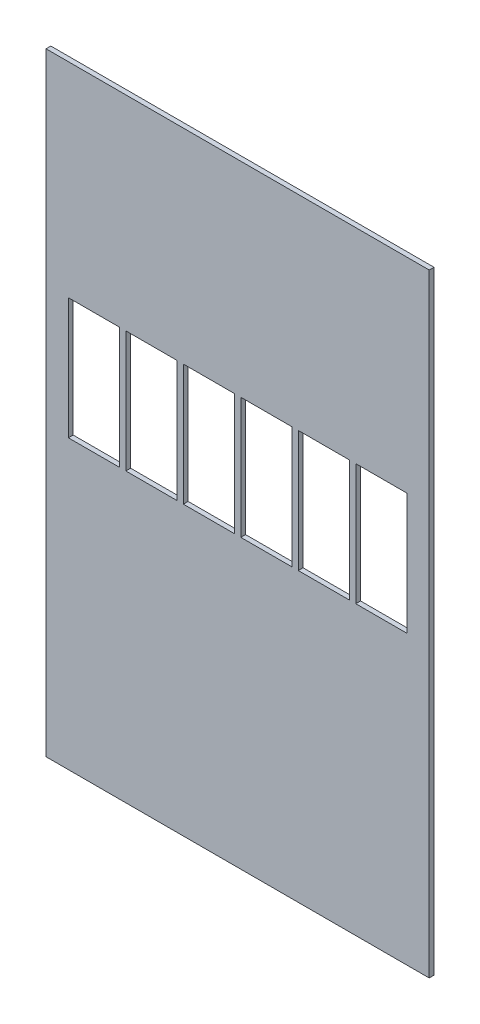
from build123d import *

# Parameters (mm, degrees)
SKETCH1_W               = 2743.2
SKETCH1_H               = 1066.8
BOSS_EXTRUDE1_DEPTH     = 38.1
CUT_EXTRUDE1_DEPTH      = 1473.159546381
CUT_EXTRUDE1_DEPTH_BACK = 1473.159546381
SKETCH2_W               = 406.4
SKETCH2_H               = 965.2
SKETCH3_W               = 2743.2
SKETCH3_H               = 38.1
BOSS_EXTRUDE2_DEPTH     = 2235.2
SKETCH4_W               = 2743.2
SKETCH4_H               = 38.1
BOSS_EXTRUDE3_DEPTH     = 1574.8
SKETCH5_W               = 38.1
SKETCH5_H               = 4876.8
BOSS_EXTRUDE4_DEPTH     = 152.4


with BuildPart() as part:
    # Sketch1 → Boss-Extrude1 (new body)
    with BuildSketch(Plane.XY):
        Rectangle(SKETCH1_W, SKETCH1_H)
    extrude(amount=BOSS_EXTRUDE1_DEPTH)

    # Sketch2 → Cut-Extrude1 (cut, two sides: drawn at the far end of the back side and taken through both)
    with BuildSketch(Plane.XY.offset(38.1).offset(-CUT_EXTRUDE1_DEPTH_BACK)):
        with Locations((-1143, 0)):
            Rectangle(SKETCH2_W, SKETCH2_H)
        with Locations((-685.8, 0)):
            Rectangle(SKETCH2_W, SKETCH2_H)
        with Locations((-228.6, 0)):
            Rectangle(SKETCH2_W, SKETCH2_H)
        with Locations((228.6, 0)):
            Rectangle(SKETCH2_W, SKETCH2_H)
        with Locations((685.8, 0)):
            Rectangle(SKETCH2_W, SKETCH2_H)
        with Locations((1143, 0)):
            Rectangle(SKETCH2_W, SKETCH2_H)
    extrude(amount=CUT_EXTRUDE1_DEPTH + CUT_EXTRUDE1_DEPTH_BACK, mode=Mode.SUBTRACT)

    # Sketch3 → Boss-Extrude2 (add)
    with BuildSketch(Plane.XZ.offset(533.4)):
        with Locations((0, 19.05)):
            Rectangle(SKETCH3_W, SKETCH3_H)
    extrude(amount=BOSS_EXTRUDE2_DEPTH)

    # Sketch4 → Boss-Extrude3 (add)
    with BuildSketch(Plane(origin=(0, 533.4, 0), x_dir=(1, 0, 0), z_dir=(0, 1, 0))):
        with Locations((0, -19.05)):
            Rectangle(SKETCH4_W, SKETCH4_H)
    extrude(amount=BOSS_EXTRUDE3_DEPTH)

    # Sketch5 → Boss-Extrude4 (add)
    with BuildSketch(Plane.ZY.offset(1371.6)):
        with Locations((19.05, -330.2)):
            Rectangle(SKETCH5_W, SKETCH5_H)
    boss_extrude4 = extrude(amount=BOSS_EXTRUDE4_DEPTH)

    # Mirror1: Boss-Extrude4 across plane
    add(boss_extrude4.mirror(Plane(origin=(0, 0, 0), x_dir=(0, 0, 1), z_dir=(1, 0, 0))))


solid = part.part
